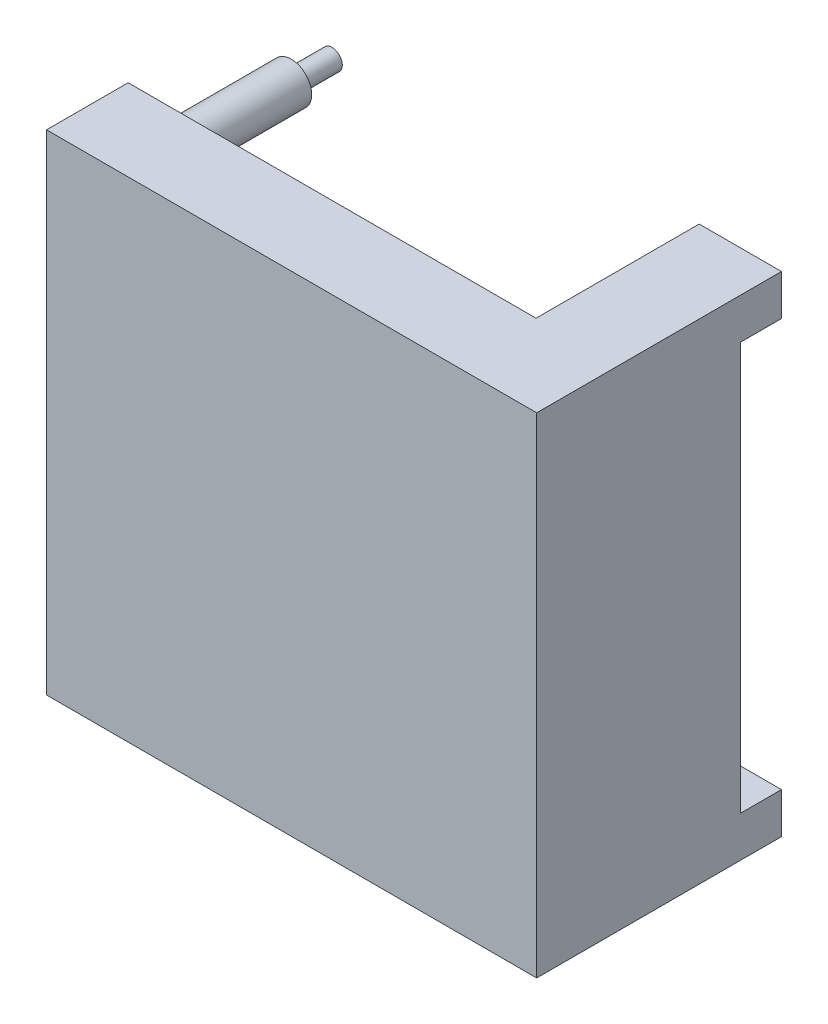
from build123d import *

# Parameters (mm, degrees)
EXTRUDE_1_DEPTH     = 60
SKETCH_3_W          = 10
SKETCH_3_H          = 40
CUT_EXTRUDE_2_DEPTH = 148.102218349
EXTRUDE_4_DEPTH     = 30
EXTRUDE_5_DEPTH     = 30
SKETCH_9_R          = 5
EXTRUDE_6_DEPTH     = 30
SKETCH_10_R         = 2.5
EXTRUDE_7_DEPTH     = 10
SKETCH_11_W         = 20.162650783
SKETCH_11_H         = 30
CUT_EXTRUDE_3_DEPTH = 10


with BuildPart() as part:
    # 草图1 → 凸台-拉伸1 (new body)
    with BuildSketch(Plane(origin=(0, 0, 0), x_dir=(1, 0, 0), z_dir=(0, 1, 0))):
        Polygon((0, 0), (120.162650783, 0), (120.162650783, 60), (100, 60), (100, 20), (0, 20), align=None)
    extrude(amount=EXTRUDE_1_DEPTH)

    # 草图3 → 切除-拉伸2 (cut, through all)
    with BuildSketch(Plane(origin=(120.162650783, 0, 0), x_dir=(0, 0, -1), z_dir=(1, 0, 0))):
        with Locations((55, 30)):
            Rectangle(SKETCH_3_W, SKETCH_3_H)
    extrude(amount=-CUT_EXTRUDE_2_DEPTH, mode=Mode.SUBTRACT)

    # 草图7 → 凸台-拉伸4 (add)
    with BuildSketch(Plane(origin=(0, 60, 0), x_dir=(1, 0, 0), z_dir=(0, 1, 0))):
        Polygon((0, 20), (0, 0), (120.162650783, 0), (120.162650783, 60), (100, 60), (100, 20), align=None)
    extrude(amount=EXTRUDE_4_DEPTH)

    # 草图8 → 凸台-拉伸5 (add)
    with BuildSketch(Plane.XZ):
        Polygon((0, -20), (0, 0), (120.162650783, 0), (120.162650783, -60), (100, -60), (100, -20), align=None)
    extrude(amount=EXTRUDE_5_DEPTH)

    # 草图9 → 凸台-拉伸6 (add)
    with BuildSketch(Plane(origin=(0, 0, -20), x_dir=(-1, 0, 0), z_dir=(0, 0, -1))):
        with Locations(Location((-10, -20, 0), (0, 0, 180))):
            Circle(SKETCH_9_R)
        with Locations(Location((-10, 80, 0), (0, 0, 180))):
            Circle(SKETCH_9_R)
    extrude(amount=EXTRUDE_6_DEPTH)

    # 草图10 → 凸台-拉伸7 (add)
    with BuildSketch(Plane(origin=(0, 0, -50), x_dir=(-1, 0, 0), z_dir=(0, 0, -1))):
        with Locations((-10, -20)):
            Circle(SKETCH_10_R)
        with Locations((-10, 80)):
            Circle(SKETCH_10_R)
    extrude(amount=EXTRUDE_7_DEPTH)

    # 草图11 → 切除-拉伸3 (cut)
    with BuildSketch(Plane(origin=(0, 0, -60), x_dir=(-1, 0, 0), z_dir=(0, 0, -1))):
        with Locations((-110.081325392, -5)):
            Rectangle(SKETCH_11_W, SKETCH_11_H)
        with Locations((-110.081325392, 65)):
            Rectangle(SKETCH_11_W, SKETCH_11_H)
    extrude(amount=-CUT_EXTRUDE_3_DEPTH, mode=Mode.SUBTRACT)


solid = part.part
